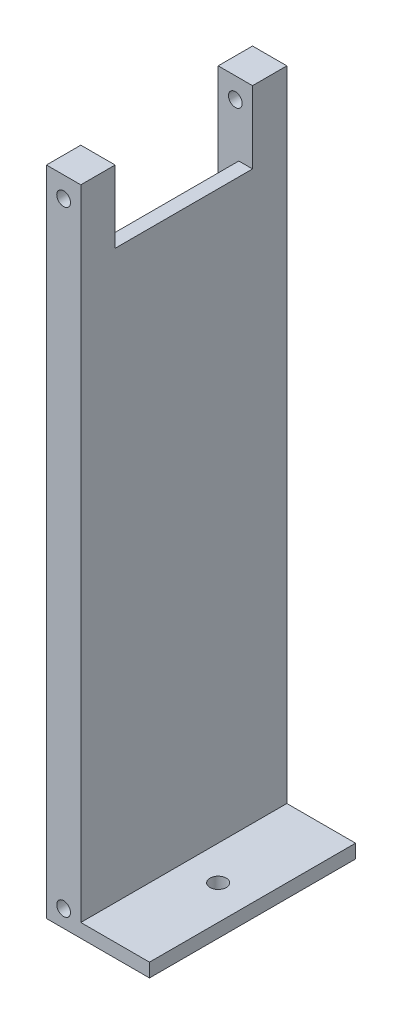
from build123d import *

# Parameters (mm, degrees)
SKETCH2_W                       = 30
SKETCH2_H                       = 95
BOSS_EXTRUDE1_DEPTH             = 5
F_2MM_DIAMETER_HOLE_D           = 2
SKETCH6_W                       = 30
SKETCH6_H                       = 2
BOSS_EXTRUDE2_DEPTH             = 10
F_3_32_0_09375_DIAMETER_HOLE2_D = 2.38125
SKETCH10_W                      = 20
SKETCH10_H                      = 15
CUT_EXTRUDE3_DEPTH              = 3
SKETCH11_W                      = 20
SKETCH11_H                      = 10.5
CUT_EXTRUDE4_DEPTH              = 52.237193522
F_2MM_DIAMETER_HOLE2_D          = 2


with BuildPart() as part:
    # Sketch2 → Boss-Extrude1 (new body)
    with BuildSketch(Plane(origin=(0, 0, 0), x_dir=(0, 0, -1), z_dir=(1, 0, 0))):
        Rectangle(SKETCH2_W, SKETCH2_H)
    extrude(amount=BOSS_EXTRUDE1_DEPTH)

    # 2mm Diameter Hole (through all)
    with Locations(Plane(origin=(0, 0, -15), x_dir=(-1, 0, 0), z_dir=(0, 0, -1))):
        with Locations((-2.5, 44.5)):
            Hole(F_2MM_DIAMETER_HOLE_D / 2)

    # Sketch6 → Boss-Extrude2 (add)
    with BuildSketch(Plane(origin=(5, 0, 0), x_dir=(0, 0, -1), z_dir=(1, 0, 0))):
        with Locations((0, -46.5)):
            Rectangle(SKETCH6_W, SKETCH6_H)
    extrude(amount=BOSS_EXTRUDE2_DEPTH)

    # 3/32 (0.09375) Diameter Hole2 (through all)
    with Locations(Plane(origin=(0, -45.5, 0), x_dir=(1, 0, 0), z_dir=(0, 1, 0))):
        with Locations((10, 0)):
            Hole(F_3_32_0_09375_DIAMETER_HOLE2_D / 2)

    # Sketch10 → Cut-Extrude3 (cut)
    with BuildSketch(Plane.ZY):
        with Locations((0, 40)):
            Rectangle(SKETCH10_W, SKETCH10_H)
    extrude(amount=-CUT_EXTRUDE3_DEPTH, mode=Mode.SUBTRACT)

    # Sketch11 → Cut-Extrude4 (cut, through all)
    with BuildSketch(Plane.ZY.offset(-3)):
        with Locations((0, 42.25)):
            Rectangle(SKETCH11_W, SKETCH11_H)
    extrude(amount=-CUT_EXTRUDE4_DEPTH, mode=Mode.SUBTRACT)

    # 2mm Diameter Hole2 (through all)
    with Locations(Plane(origin=(0, 0, -15), x_dir=(-1, 0, 0), z_dir=(0, 0, -1))):
        with Locations((-2.5, -45)):
            Hole(F_2MM_DIAMETER_HOLE2_D / 2)


solid = part.part
